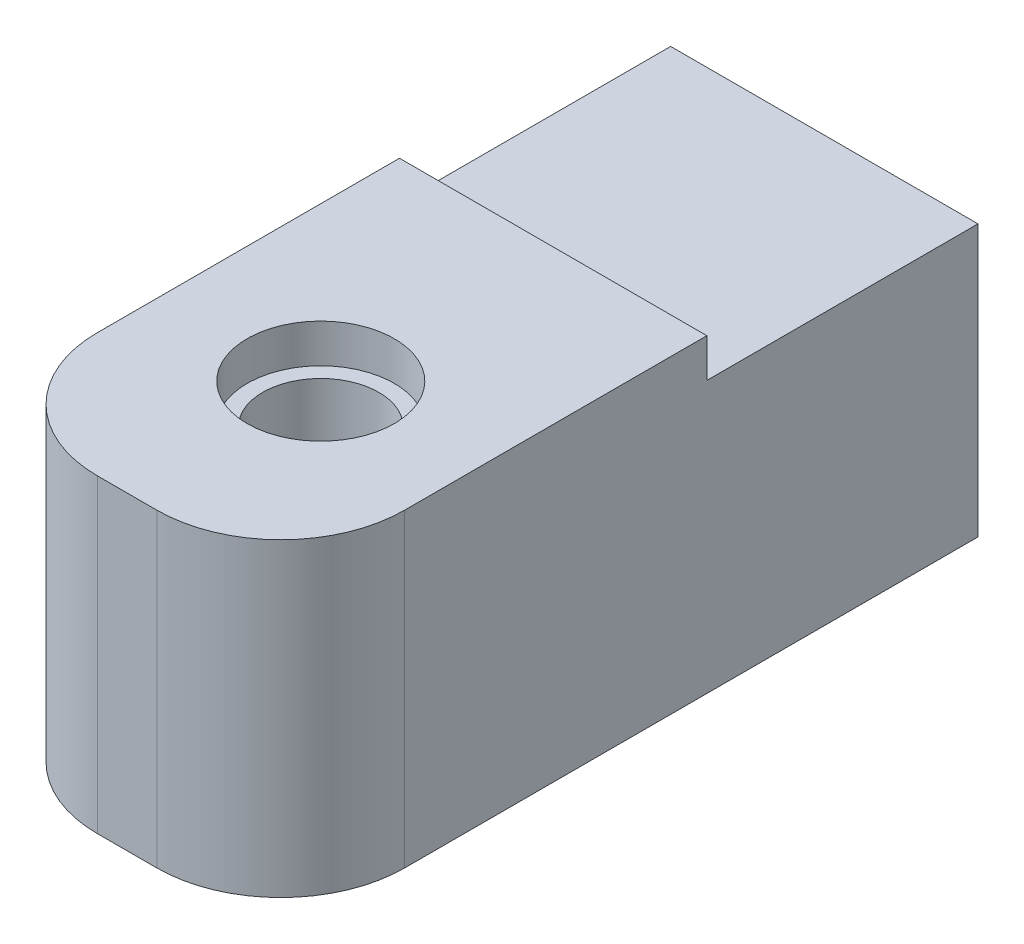
from build123d import *

# Parameters (mm, degrees)
SKETCH1_W           = 25.191803279
SKETCH1_H           = 25.4
BOSS_EXTRUDE1_DEPTH = 57.15
SKETCH2_R           = 4.696654448
CUT_EXTRUDE1_DEPTH  = 30.1752
SKETCH3_W           = 22.225
SKETCH3_H           = 3.175
CUT_EXTRUDE2_DEPTH  = 30.1752
SKETCH11_R          = 6.0325
CUT_EXTRUDE5_DEPTH  = 3.175
SKETCH12_R          = 4.7625
CUT_EXTRUDE6_DEPTH  = 69.029075152
FILLET1_R           = 10.16
FILLET2_R           = 10.16


with BuildPart() as part:
    # Sketch1 → Boss-Extrude1 (new body)
    with BuildSketch(Plane.XY):
        with Locations((-16.863934427, -3.487295082)):
            Rectangle(SKETCH1_W, SKETCH1_H)
    extrude(amount=BOSS_EXTRUDE1_DEPTH)

    # Sketch2 → Cut-Extrude1 (cut)
    with BuildSketch(Plane(origin=(0, 0, 0), x_dir=(-1, 0, 0), z_dir=(0, 0, -1))):
        with Locations((16.89886731, -3.452362198)):
            Circle(SKETCH2_R)
    extrude(amount=-CUT_EXTRUDE1_DEPTH, mode=Mode.SUBTRACT)

    # Sketch3 → Cut-Extrude2 (cut)
    with BuildSketch(Plane(origin=(-4.268032787, 0, 0), x_dir=(0, 0, -1), z_dir=(1, 0, 0))):
        with Locations((-11.1125, 7.625204918)):
            Rectangle(SKETCH3_W, SKETCH3_H)
    extrude(amount=-CUT_EXTRUDE2_DEPTH, mode=Mode.SUBTRACT)

    # Sketch11 → Cut-Extrude5 (cut)
    with BuildSketch(Plane(origin=(0, 9.212704918, 0), x_dir=(1, 0, 0), z_dir=(0, 1, 0))):
        with Locations(Location((-16.863934426, -41.275, 0), (0, 0, 270))):
            Circle(SKETCH11_R)
    extrude(amount=-CUT_EXTRUDE5_DEPTH, mode=Mode.SUBTRACT)

    # Sketch12 → Cut-Extrude6 (cut, through all)
    with BuildSketch(Plane(origin=(0, 6.037704918, 0), x_dir=(1, 0, 0), z_dir=(0, 1, 0))):
        with Locations(Location((-16.863934426, -41.275, 0), (0, 0, 270))):
            Circle(SKETCH12_R)
    extrude(amount=-CUT_EXTRUDE6_DEPTH, mode=Mode.SUBTRACT)

    # Fillet1
    fillet1_edges = [part.edges().sort_by_distance(p)[0] for p in [
        (-4.268032787, -3.487295082, 57.15),
    ]]
    fillet(fillet1_edges, radius=FILLET1_R)

    # Fillet2
    fillet2_edges = [part.edges().sort_by_distance(p)[0] for p in [
        (-29.459836066, -3.487295082, 57.15),
    ]]
    fillet(fillet2_edges, radius=FILLET2_R)


solid = part.part
